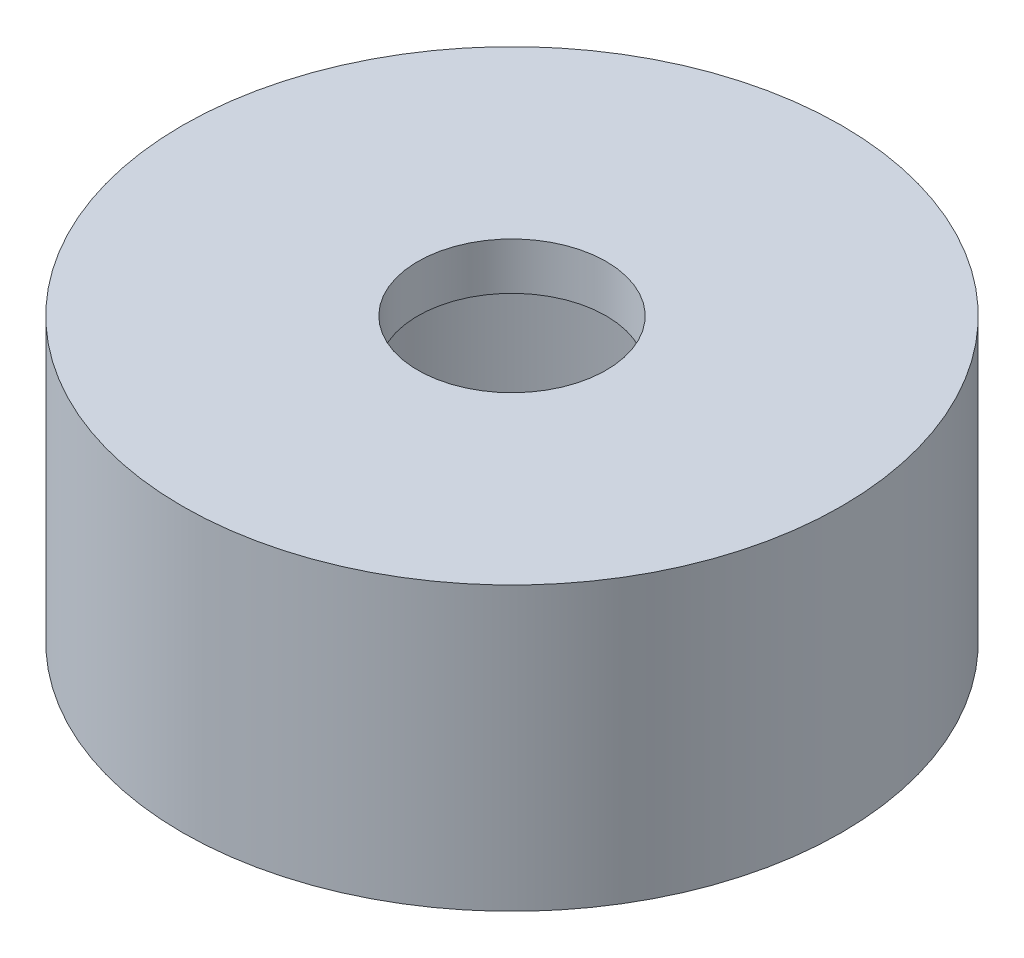
from build123d import *


with BuildPart() as part:
    # Schizzo1 → Rivoluzione1 (revolve)
    with BuildSketch(Plane.XY, mode=Mode.PRIVATE) as rivoluzione1_sk:
        Polygon((-12, 0), (-12, 10), (-4, 10), (-4, 12), (-14, 12), (-14, 0), align=None)
    revolve(rivoluzione1_sk.sketch.rotate(Axis((0, 0, 0), (0, 1, 0)), 270), axis=Axis((0, 0, 0), (0, 1, 0)))


solid = part.part
